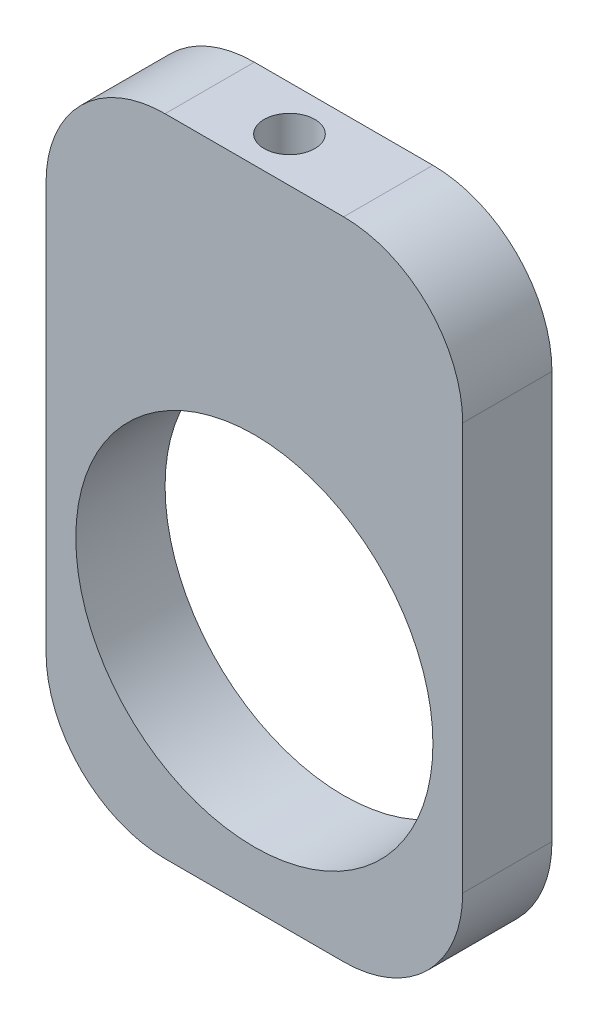
from build123d import *

# Parameters (mm, degrees)
SKETCH1_R                     = 9.525
BOSS_EXTRUDE2_DEPTH           = 4.7625
TAP_DRILL_FOR_6_32_TAP1_D     = 2.7051
TAP_DRILL_FOR_6_32_TAP1_DEPTH = 19.05
TAP_DRILL_FOR_6_32_TAP1_TIP   = 0.81269403


with BuildPart() as part:
    # Sketch1 → Boss-Extrude2 (new body)
    # profile 1 of 2: a face of its own
    with BuildSketch(Plane.XY):
        with BuildLine():
            Line((4.7625, 21.971), (-4.7625, 21.971))
            ThreePointArc((-4.7625, 21.971), (-9.252628061, 20.111128061), (-11.1125, 15.621))
            Line((-11.1125, 15.621), (-11.1125, 12.446))
            Line((-11.1125, 12.446), (11.1125, 12.446))
            Line((11.1125, 12.446), (11.1125, 15.621))
            ThreePointArc((11.1125, 15.621), (9.252628061, 20.111128061), (4.7625, 21.971))
        make_face()
    # profile 2 of 2: a face of its own
    with BuildSketch(Plane.XY):
        with BuildLine():
            Line((4.7625, -12.446), (-4.7625, -12.446))
            ThreePointArc((-4.7625, -12.446), (-9.252628061, -10.586128061), (-11.1125, -6.096))
            Line((-11.1125, -6.096), (-11.1125, 12.446))
            Line((-11.1125, 12.446), (11.1125, 12.446))
            Line((11.1125, 12.446), (11.1125, -6.096))
            ThreePointArc((11.1125, -6.096), (9.252628061, -10.586128061), (4.7625, -12.446))
        make_face()
        with Locations(Location((0, 0, 0), (0, 0, 180))):
            Circle(SKETCH1_R, mode=Mode.SUBTRACT)
    extrude(amount=BOSS_EXTRUDE2_DEPTH)

    # Tap Drill for #6-32 Tap1
    with Locations(Plane(origin=(0, 21.971, 0), x_dir=(1, 0, 0), z_dir=(0, 1, 0))):
        with Locations((-0.508, -2.38125)):
            Hole(TAP_DRILL_FOR_6_32_TAP1_D / 2, depth=TAP_DRILL_FOR_6_32_TAP1_DEPTH)
            with Locations((0, 0, -(TAP_DRILL_FOR_6_32_TAP1_DEPTH + TAP_DRILL_FOR_6_32_TAP1_TIP / 2))):  # 118° drill point
                Cone(0, TAP_DRILL_FOR_6_32_TAP1_D / 2, TAP_DRILL_FOR_6_32_TAP1_TIP, mode=Mode.SUBTRACT)


solid = part.part
